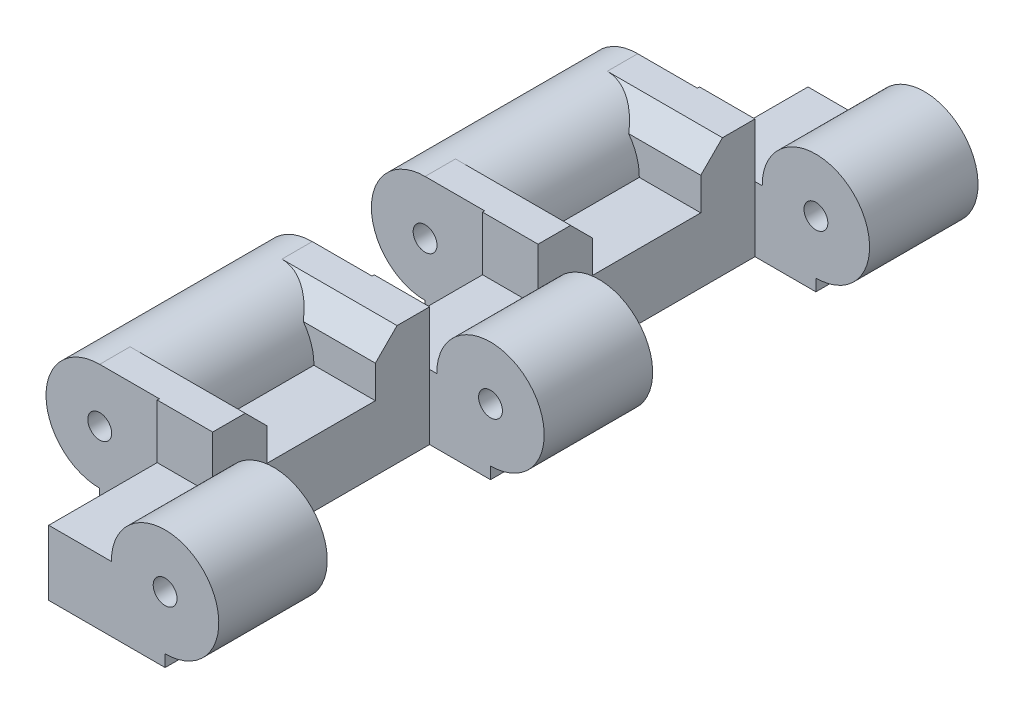
from build123d import *

# Parameters (mm, degrees)
SKETCH1_W             = 10.6165
SKETCH1_H             = 20
SKETCH1_W_2           = 10.732
SKETCH1_H_2           = 10
BOSS_EXTRUDE1_DEPTH   = 6
SKETCH2_W             = 10.6165
SKETCH2_H             = 5
BOSS_EXTRUDE2_DEPTH   = 5
CHAMFER1_SIZE         = 2
BOSS_EXTRUDE3_START   = -10
SKETCH3_R             = 4.95
BOSS_EXTRUDE3_DEPTH   = 20
BOSS_EXTRUDE4_START   = 10
SKETCH3_3_R           = 4.95
BOSS_EXTRUDE4_DEPTH   = 10
BOSS_EXTRUDE5_START   = -20
SKETCH3_4_R           = 4.95
BOSS_EXTRUDE5_DEPTH   = 10
BOSS_EXTRUDE6_START   = -40
SKETCH3_5_R           = 4.95
BOSS_EXTRUDE6_DEPTH   = 20
BOSS_EXTRUDE7_START   = -50
SKETCH3_6_R           = 4.95
BOSS_EXTRUDE7_DEPTH   = 10
F_1_0MM_DOWEL_HOLE1_D = 2.2
CUT_EXTRUDE1_START    = -0.2
CUT_EXTRUDE1_DEPTH    = 0.2
CUT_EXTRUDE2_START    = -30.2
CUT_EXTRUDE2_DEPTH    = 10.4
CUT_EXTRUDE3_START    = -50
CUT_EXTRUDE3_DEPTH    = 0.2


with BuildPart() as part:
    # Sketch1 → Boss-Extrude1 (new body)
    with BuildSketch(Plane(origin=(0, 0, 0), x_dir=(1, 0, 0), z_dir=(0, 1, 0))):
        Polygon((16.2325, -10), (10.6165, -10), (5.5005, -10), (5.5005, -20), (16.2325, -20), align=None)
        Polygon((10.6165, 0), (0, 0), (0, -10), (5.5005, -10), (10.6165, -10), align=None)
        Polygon((0, 10), (0, 0), (10.6165, 0), (10.6165, 10), (5.5005, 10), align=None)
        Polygon((5.5005, 10), (10.6165, 10), (16.2325, 10), (16.2325, 20), (10.6165, 20), (5.5005, 20), align=None)
        with Locations((5.30825, 30)):
            Rectangle(SKETCH1_W, SKETCH1_H)
        with Locations((10.8665, 45)):
            Rectangle(SKETCH1_W_2, SKETCH1_H_2)
    extrude(amount=BOSS_EXTRUDE1_DEPTH)

    # Sketch2 → Boss-Extrude2 (add)
    with BuildSketch(Plane(origin=(0, 6, 0), x_dir=(1, 0, 0), z_dir=(0, 1, 0))):
        with Locations((5.30825, 7.5)):
            Rectangle(SKETCH2_W, SKETCH2_H)
        with Locations((5.30825, -7.5)):
            Rectangle(SKETCH2_W, SKETCH2_H)
        with Locations((5.30825, 37.5)):
            Rectangle(SKETCH2_W, SKETCH2_H)
        with Locations((5.30825, 22.5)):
            Rectangle(SKETCH2_W, SKETCH2_H)
    extrude(amount=BOSS_EXTRUDE2_DEPTH)

    # Chamfer1
    chamfer1_edges = [part.edges().sort_by_distance(p)[0] for p in [
        (5.30825, 11, -35),
        (5.30825, 11, -25),
        (5.30825, 11, -5),
        (5.30825, 11, 5),
    ]]
    chamfer(chamfer1_edges, length=CHAMFER1_SIZE)

    # Sketch3 → Boss-Extrude3 (add)
    with BuildSketch(Plane.XY.offset(BOSS_EXTRUDE3_START)):
        with Locations((0, 6.05)):
            Circle(SKETCH3_R)
    extrude(amount=BOSS_EXTRUDE3_DEPTH)

    # Sketch3<3> → Boss-Extrude4 (add)
    with BuildSketch(Plane.XY.offset(BOSS_EXTRUDE4_START)):
        with Locations((16.2325, 6.05)):
            Circle(SKETCH3_3_R)
    extrude(amount=BOSS_EXTRUDE4_DEPTH)

    # Sketch3<4> → Boss-Extrude5 (add)
    with BuildSketch(Plane.XY.offset(BOSS_EXTRUDE5_START)):
        with Locations((16.2325, 6.05)):
            Circle(SKETCH3_4_R)
    extrude(amount=BOSS_EXTRUDE5_DEPTH)

    # Sketch3<5> → Boss-Extrude6 (add)
    with BuildSketch(Plane.XY.offset(BOSS_EXTRUDE6_START)):
        with Locations((0, 6.05)):
            Circle(SKETCH3_5_R)
    extrude(amount=BOSS_EXTRUDE6_DEPTH)

    # Sketch3<6> → Boss-Extrude7 (add)
    with BuildSketch(Plane.XY.offset(BOSS_EXTRUDE7_START)):
        with Locations((16.2325, 6.05)):
            Circle(SKETCH3_6_R)
    extrude(amount=BOSS_EXTRUDE7_DEPTH)

    # Ø1.0mm Dowel Hole1 (through all)
    with Locations(Plane.XY.offset(20)):
        with Locations((0, 6.05), (16.2325, 6.05)):
            Hole(F_1_0MM_DOWEL_HOLE1_D / 2)

    # Sketch9 → Cut-Extrude1 (cut)
    with BuildSketch(Plane.XY.offset(10).offset(CUT_EXTRUDE1_START)):
        with BuildLine():
            Line((5.5005, 6), (5.5005, 11))
            Line((5.5005, 11), (0, 11))
            ThreePointArc((0, 11), (-4.95, 6.05), (0, 1.1))
            Line((0, 1.1), (0, 0))
            Line((0, 0), (5.5005, 0))
            Line((5.5005, 0), (5.5005, 6))
        make_face()
    extrude(amount=CUT_EXTRUDE1_DEPTH, mode=Mode.SUBTRACT)

    # Sketch9<2> → Cut-Extrude2 (cut)
    with BuildSketch(Plane.XY.offset(10).offset(CUT_EXTRUDE2_START)):
        with BuildLine():
            Line((5.5005, 0), (5.5005, 6))
            Line((5.5005, 6), (5.5005, 11))
            Line((5.5005, 11), (0, 11))
            ThreePointArc((0, 11), (-4.95, 6.05), (0, 1.1))
            Line((0, 1.1), (0, 0))
            Line((0, 0), (5.5005, 0))
        make_face()
    extrude(amount=CUT_EXTRUDE2_DEPTH, mode=Mode.SUBTRACT)

    # Sketch9<4> → Cut-Extrude3 (cut)
    with BuildSketch(Plane.XY.offset(10).offset(CUT_EXTRUDE3_START)):
        with BuildLine():
            Line((5.5005, 0), (5.5005, 6))
            Line((5.5005, 6), (5.5005, 11))
            Line((5.5005, 11), (0, 11))
            ThreePointArc((0, 11), (-4.95, 6.05), (0, 1.1))
            Line((0, 1.1), (0, 0))
            Line((0, 0), (5.5005, 0))
        make_face()
    extrude(amount=CUT_EXTRUDE3_DEPTH, mode=Mode.SUBTRACT)


solid = part.part
